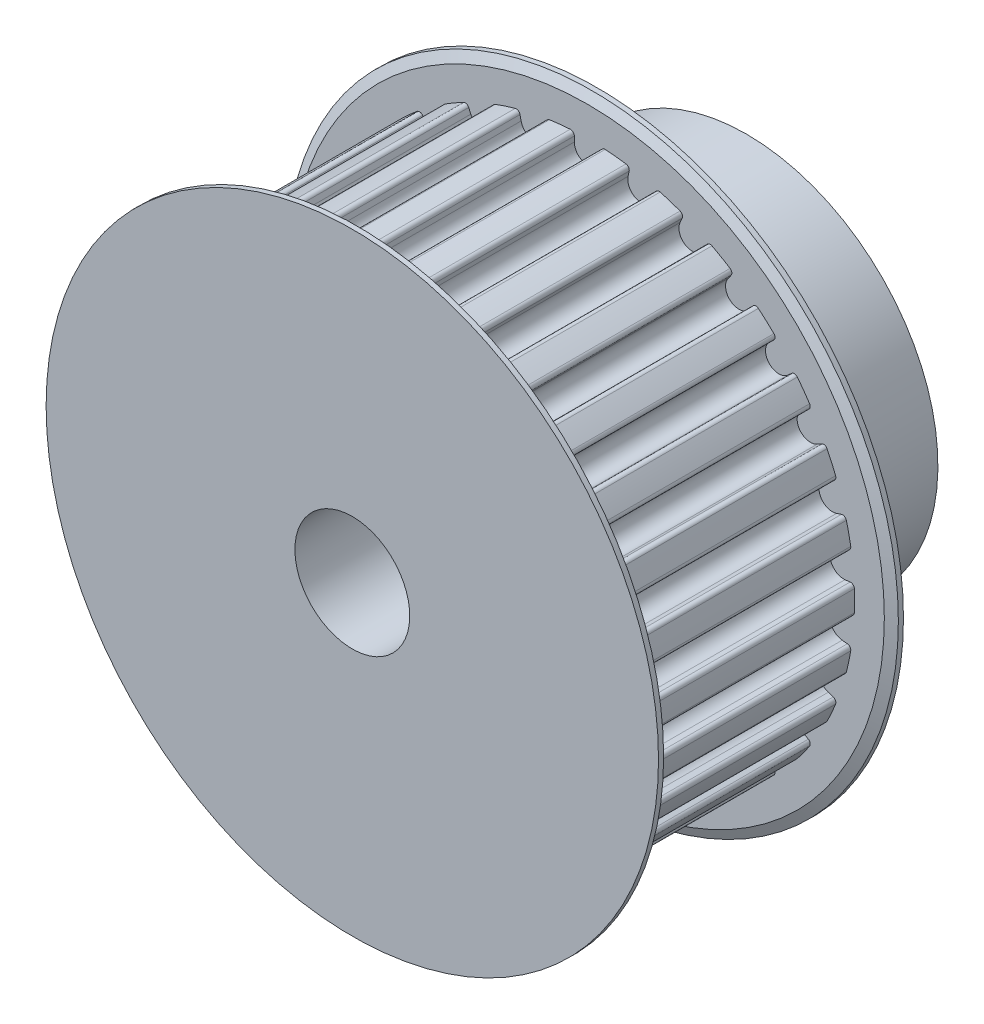
from build123d import *

# Parameters (mm, degrees)
SKETCH5_W           = 12.8
SKETCH5_H           = 13.945
SKETCH16_W          = 7.8
SKETCH16_H          = 10
SKETCH17_W          = 20.6
SKETCH17_H          = 3
CUT_TOOTH_REACH     = 30.518
PATTERN_TOOTH_COUNT = 30
SKETCH_1_R          = 1
CUT_EXTRUDE_1_DEPTH = 18


with BuildPart() as part:
    # Sketch5 → body (revolve)
    with BuildSketch(Plane(origin=(0, 0, 0), x_dir=(0, 0, -1), z_dir=(1, 0, 0))):
        with Locations((6.4, 6.9725)):
            Rectangle(SKETCH5_W, SKETCH5_H)
    revolve(axis=Axis((0, 0, 0), (0, 0, -1)))

    # Sketch16 → body-hub (revolve)
    with BuildSketch(Plane(origin=(0, 0, 0), x_dir=(0, 0, -1), z_dir=(1, 0, 0))):
        with Locations((16.7, 5)):
            Rectangle(SKETCH16_W, SKETCH16_H)
    revolve(axis=Axis((0, 0, -20.6), (0, 0, 1)))

    # Sketch17 → body-bore (revolve, cut)
    with BuildSketch(Plane(origin=(0, 0, 0), x_dir=(0, 0, -1), z_dir=(1, 0, 0))):
        with Locations((10.3, 1.5)):
            Rectangle(SKETCH17_W, SKETCH17_H)
    revolve(axis=Axis((0, 0, -20.6), (0, 0, 1)), mode=Mode.SUBTRACT)

    # Sketch23 → cut-tooth (cut, up to next)
    with BuildSketch(Plane.XY, mode=Mode.PRIVATE) as cut_tooth_sk1:
        with BuildLine():
            Line((0.7, 13.445), (0.7, 13.71550309))
            ThreePointArc((0.7, 13.71550309), (0.763287042, 13.861481057), (0.913095671, 13.915073888))
            Line((0.913095671, 13.915073888), (0.913095671, 15.085147775))
            Line((0.913095671, 15.085147775), (-0.913095671, 15.085147775))
            Line((-0.913095671, 15.085147775), (-0.913095671, 13.915073888))
            ThreePointArc((-0.913095671, 13.915073888), (-0.763287042, 13.861481057), (-0.7, 13.71550309))
            Line((-0.7, 13.71550309), (-0.7, 13.445))
            ThreePointArc((-0.7, 13.445), (0, 12.745), (0.7, 13.445))
        make_face()
    cut_tooth_tool1 = extrude(cut_tooth_sk1.sketch, amount=-CUT_TOOTH_REACH, mode=Mode.PRIVATE) & part.part
    cut_tooth = cut_tooth_tool1.solids().sort_by_distance((0, 14.055844, 0))[0]
    add(cut_tooth, mode=Mode.SUBTRACT)

    # pattern-tooth: cut-tooth ×30 about axis
    pattern_tooth_axis = Axis((0, 0, -12.8), (0, 0, 1))
    for i in range(1, PATTERN_TOOTH_COUNT):
        add(cut_tooth.rotate(pattern_tooth_axis, i * 360 / PATTERN_TOOTH_COUNT), mode=Mode.SUBTRACT)

    # Sketch25 → body-flange-front (revolve)
    with BuildSketch(Plane(origin=(0, 0, 0), x_dir=(0, 0, -1), z_dir=(1, 0, 0))):
        Polygon((0.5, 6.9795), (0, 6.9795), (0, 12.993166667), (0, 16), (0.5, 16), (0.5, 12.993166667), align=None)
    revolve(axis=Axis((0, 0, 0), (0, 0, -1)))

    # Sketch26 → body-flange-back (revolve)
    with BuildSketch(Plane(origin=(0, 0, 0), x_dir=(0, 0, -1), z_dir=(1, 0, 0))):
        Polygon((12.3, 6.9795), (12.8, 6.9795), (12.8, 12.993166667), (12.8, 16), (12.3, 16), (12.3, 12.993166667), align=None)
    revolve(axis=Axis((0, 0, -12.8), (0, 0, 1)))

    # Sketch28 → body-flange-profile-front (revolve, cut)
    with BuildSketch(Plane(origin=(0, 0, 0), x_dir=(0, 0, -1), z_dir=(1, 0, 0))):
        Polygon((0.5, 16), (0.5, 15.5), (0.266846171, 16), align=None)
    revolve(axis=Axis((0, 0, -12.8), (0, 0, 1)), mode=Mode.SUBTRACT)

    # Sketch29 → body-flange-profile-back (revolve, cut)
    with BuildSketch(Plane(origin=(0, 0, 0), x_dir=(0, 0, -1), z_dir=(1, 0, 0))):
        Polygon((12.3, 16), (12.3, 15.5), (12.533153829, 16), align=None)
    revolve(axis=Axis((0, 0, -12.8), (0, 0, 1)), mode=Mode.SUBTRACT)

    # 草图1 → 切除-拉伸1 (cut)
    with BuildSketch(Plane(origin=(0, 0, 0), x_dir=(1, 0, 0), z_dir=(0, 1, 0))):
        with Locations((0, 17.1)):
            Circle(SKETCH_1_R)
    extrude(amount=-CUT_EXTRUDE_1_DEPTH, mode=Mode.SUBTRACT)


solid = part.part
